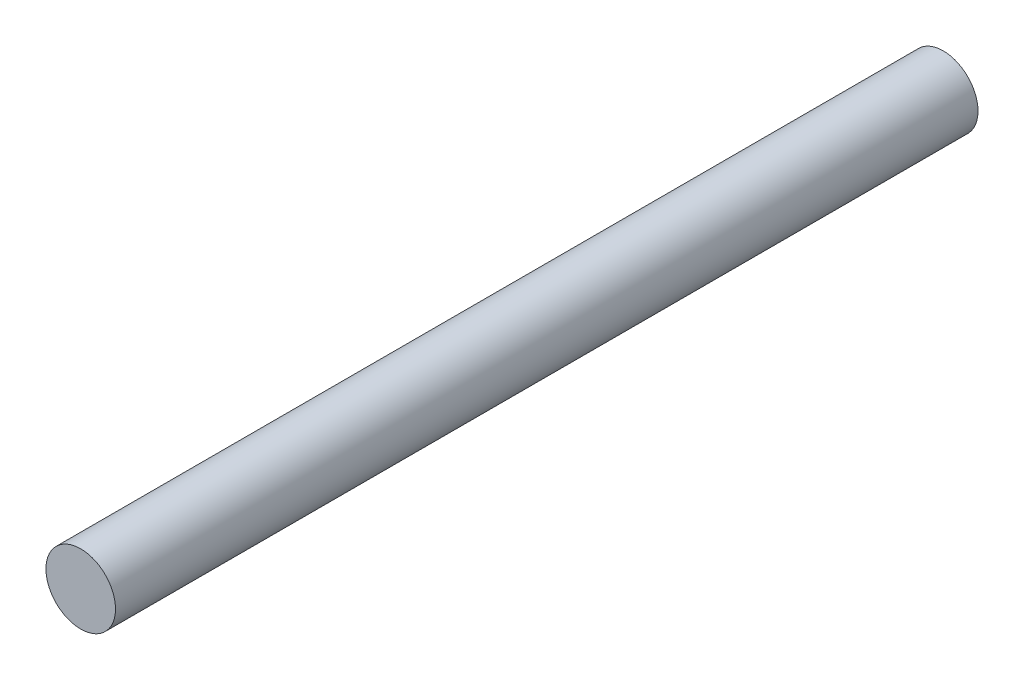
from build123d import *

# Parameters (mm, degrees)
ESQUISSE1_R        = 12.5
BOSS_EXTRU_1_DEPTH = 310


with BuildPart() as part:
    # Esquisse1 → Boss.-Extru.1 (new body)
    with BuildSketch(Plane.XY):
        Circle(ESQUISSE1_R)
    extrude(amount=BOSS_EXTRU_1_DEPTH)


solid = part.part
